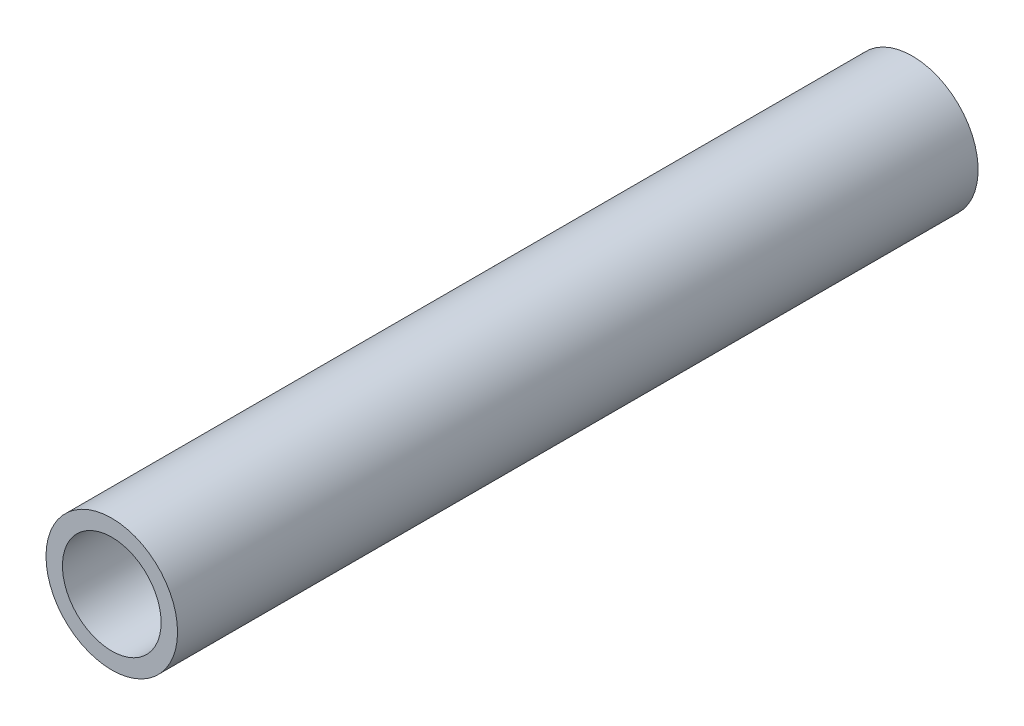
from build123d import *

# Parameters (mm, degrees)
SKETCH_1_R          = 20
EXTRUDE_1_DEPTH     = 208.44
EXTRUDE_START       = 35
SKETCH_3_R          = 20
EXTRUDE_2_DEPTH     = 35
CUT_EXTRUDE_1_DEPTH = 25
SKETCH_5_R          = 5
CUT_EXTRUDE_2_DEPTH = 10
SKETCH_6_R          = 15
CUT_EXTRUDE_3_DEPTH = 200


with BuildPart() as part:
    # 스케치1 → 보스-돌출1 (new body)
    with BuildSketch(Plane.XY):
        Circle(SKETCH_1_R)
    extrude(amount=EXTRUDE_1_DEPTH)

    # 스케치3 → 보스-돌출2 (add)
    with BuildSketch(Plane(origin=(0, 0, 0), x_dir=(-1, 0, 0), z_dir=(0, 0, -1)).offset(EXTRUDE_START)):
        Circle(SKETCH_3_R)
    extrude(amount=-EXTRUDE_2_DEPTH)

    # 스케치4 → 컷-돌출1 (cut)
    with BuildSketch(Plane(origin=(0, 0, -35), x_dir=(-1, 0, 0), z_dir=(0, 0, -1))):
        with BuildLine():
            Line((-3.515670801, 3.555286039), (-3.484261495, -3.586073317))
            ThreePointArc((-3.484261495, -3.586073317), (4.99995164, 0.021990913), (-3.515670801, 3.555286039))
        make_face()
    extrude(amount=-CUT_EXTRUDE_1_DEPTH, mode=Mode.SUBTRACT)

    # 스케치5 → 컷-돌출2 (cut)
    with BuildSketch(Plane(origin=(0, 0, -35), x_dir=(-1, 0, 0), z_dir=(0, 0, -1))):
        Circle(SKETCH_5_R)
    extrude(amount=-CUT_EXTRUDE_2_DEPTH, mode=Mode.SUBTRACT)

    # 스케치6 → 컷-돌출3 (cut)
    with BuildSketch(Plane.XY.offset(208.44)):
        Circle(SKETCH_6_R)
    extrude(amount=-CUT_EXTRUDE_3_DEPTH, mode=Mode.SUBTRACT)


solid = part.part
